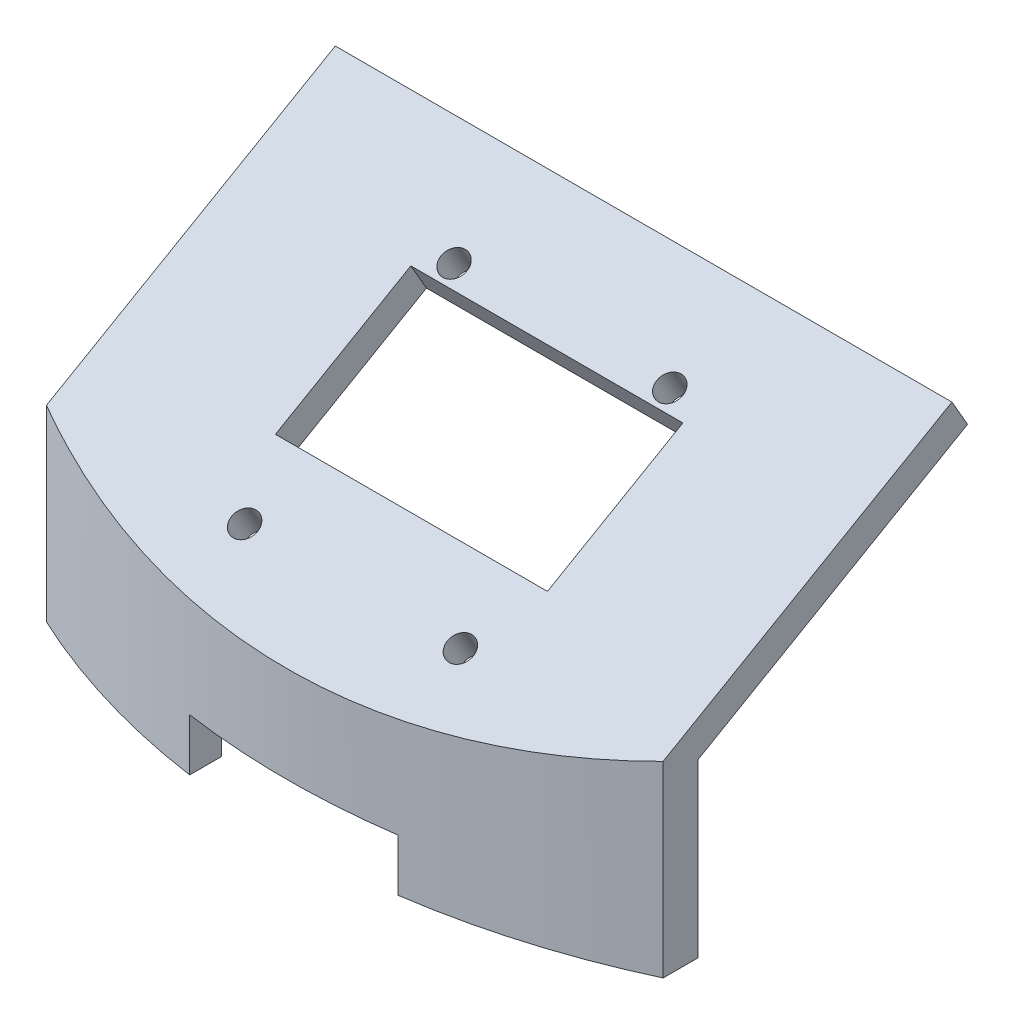
from build123d import *

# Parameters (mm, degrees)
BOSS_EXTRUDE1_DEPTH     = 18
BOSS_EXTRUDE2_DEPTH     = 3
CUT_EXTRUDE3_DEPTH      = 84.253650708
CUT_EXTRUDE3_DEPTH_BACK = 84.253650708
CUT_EXTRUDE4_DEPTH      = 84.253650708
SKETCH5_R               = 1.25
SKETCH5_W               = 26.1
SKETCH5_H               = 15
CUT_EXTRUDE1_DEPTH      = 7
SKETCH6_W               = 20
SKETCH6_H               = 10
CUT_EXTRUDE2_DEPTH      = 84.253650708


with BuildPart() as part:
    # Sketch1 → Boss-Extrude1 (new body)
    with BuildSketch(Plane(origin=(0, 0, 0), x_dir=(1, 0, 0), z_dir=(0, 1, 0))):
        with BuildLine():
            Line((-29.583278322, -63.441545093), (-29.583278322, -60.115136561))
            ThreePointArc((-29.583278322, -60.115136561), (0, -67), (29.583278322, -60.115136561))
            Line((29.583278322, -60.115136561), (29.583278322, -63.441545093))
            ThreePointArc((29.583278322, -63.441545093), (0, -70), (-29.583278322, -63.441545093))
        make_face()
    extrude(amount=BOSS_EXTRUDE1_DEPTH)

    # Sketch3 → Boss-Extrude2 (add)
    with BuildSketch(Plane(origin=(0, 40.970994853, 23.654614907), x_dir=(-1, 0, 0), z_dir=(-1.9937140685199517e-15, -0.8660254037844395, -0.49999999999999856))):
        Polygon((29.583278322, -45.941989705), (29.583278322, -13.941989705), (-29.583278322, -13.941989705), (-29.583278322, -45.941989705), (-29.583278322, -53.515041118), (29.583278322, -53.515041118), align=None)
    extrude(amount=BOSS_EXTRUDE2_DEPTH)

    # Sketch7 → Cut-Extrude3 (cut, two sides: drawn at the far end of the back side and taken through both)
    with BuildSketch(Plane(origin=(0, 0, 0), x_dir=(0, 0, -1), z_dir=(1, 0, 0)).offset(-CUT_EXTRUDE3_DEPTH_BACK)):
        Polygon((-70, 14.213474294), (-63.441545093, 18), (-70, 18), align=None)
    extrude(amount=CUT_EXTRUDE3_DEPTH + CUT_EXTRUDE3_DEPTH_BACK, mode=Mode.SUBTRACT)

    # Sketch8 → Cut-Extrude4 (cut, through all)
    with BuildSketch(Plane.XZ):
        with BuildLine():
            Line((-29.583278322, 63.441545093), (-29.583278322, 71.549825609))
            Line((-29.583278322, 71.549825609), (29.583278322, 71.549825609))
            Line((29.583278322, 71.549825609), (29.583278322, 63.441545093))
            ThreePointArc((29.583278322, 63.441545093), (0, 70), (-29.583278322, 63.441545093))
        make_face()
    extrude(amount=-CUT_EXTRUDE4_DEPTH, mode=Mode.SUBTRACT)

    # Sketch5 → Cut-Extrude1 (cut)
    with BuildSketch(Plane(origin=(0, 40.970994853, 23.654614907), x_dir=(1, 0, 0), z_dir=(2.0433685445882858e-15, 0.8660254037844395, 0.49999999999999845))):
        with Locations(Location((-10.35, -22.991989705, 0), (0, 0, 270))):
            Circle(SKETCH5_R)
        with Locations(Location((10.35, -22.991989705, 0), (0, 0, 270))):
            Circle(SKETCH5_R)
        with Locations(Location((10.35, -46.191989705, 0), (0, 0, 270))):
            Circle(SKETCH5_R)
        with Locations(Location((-10.35, -46.191989705, 0), (0, 0, 270))):
            Circle(SKETCH5_R)
        with Locations((0, -32.161989705)):
            Rectangle(SKETCH5_W, SKETCH5_H)
    extrude(amount=-CUT_EXTRUDE1_DEPTH, mode=Mode.SUBTRACT)

    # Sketch6 → Cut-Extrude2 (cut, through all)
    with BuildSketch(Plane.XY):
        Rectangle(SKETCH6_W, SKETCH6_H)
    extrude(amount=CUT_EXTRUDE2_DEPTH, mode=Mode.SUBTRACT)


solid = part.part
